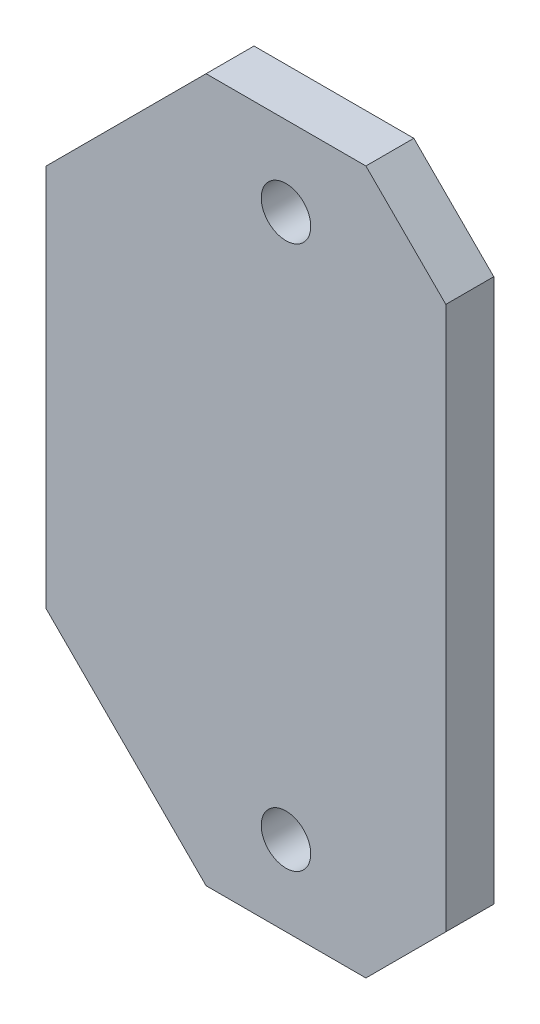
from build123d import *

# Parameters (mm, degrees)
SKETCH1_W           = 25
SKETCH1_H           = 44
BOSS_EXTRUDE1_DEPTH = 3
CHAMFER1_SIZE       = 10
CHAMFER2_SIZE       = 5
SKETCH2_R           = 1.55
CUT_EXTRUDE1_DEPTH  = 3


with BuildPart() as part:
    # Sketch1 → Boss-Extrude1 (new body)
    with BuildSketch(Plane.XY):
        with Locations((0.872372372, -2.048048048)):
            Rectangle(SKETCH1_W, SKETCH1_H)
    extrude(amount=BOSS_EXTRUDE1_DEPTH)

    # Chamfer1
    chamfer1_edges = [part.edges().sort_by_distance(p)[0] for p in [
        (-11.627627628, 19.951951952, 1.5),
        (-11.627627628, -24.048048048, 1.5),
    ]]
    chamfer(chamfer1_edges, length=CHAMFER1_SIZE)

    # Chamfer2
    chamfer2_edges = [part.edges().sort_by_distance(p)[0] for p in [
        (13.372372372, 19.951951952, 1.5),
        (13.372372372, -24.048048048, 1.5),
    ]]
    chamfer(chamfer2_edges, length=CHAMFER2_SIZE)

    # Sketch2 → Cut-Extrude1 (cut)
    with BuildSketch(Plane.XY.offset(3)):
        with Locations((3.372372372, 14.951951952)):
            Circle(SKETCH2_R)
        with Locations((3.372372372, -19.048048048)):
            Circle(SKETCH2_R)
    extrude(amount=-CUT_EXTRUDE1_DEPTH, mode=Mode.SUBTRACT)


solid = part.part
